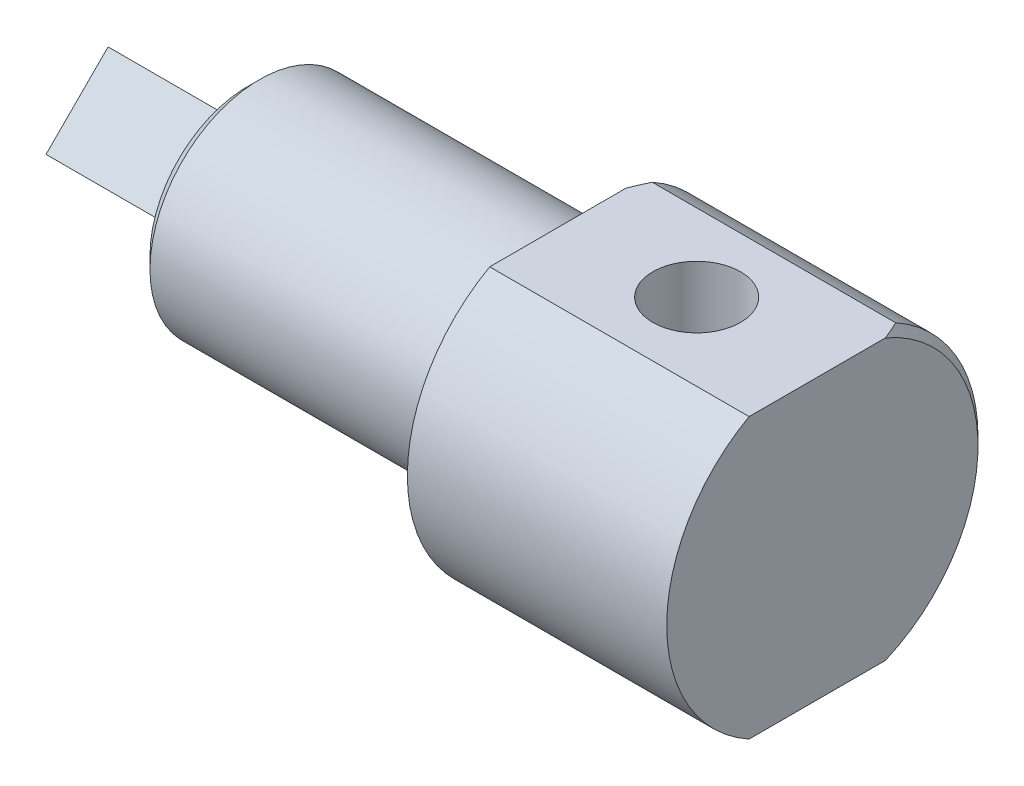
from build123d import *

# Parameters (mm, degrees)
EXTRUDE_1_DEPTH          = 35
SKETCH_4_W               = 45
SKETCH_4_H               = 5
CUT_EXTRUDE_1_DEPTH      = 8
CUT_EXTRUDE_2_DEPTH      = 189.679622641
CUT_EXTRUDE_3_DEPTH      = 166.90660023
CUT_EXTRUDE_3_DEPTH_BACK = 166.90660023
SKETCH_6_R               = 11
CHAMFER_1_SIZE           = 2
CHAMFER_2_SIZE           = 3


with BuildPart() as part:
    # Эскиз1 → Повернуть1 (revolve)
    with BuildSketch(Plane.XY, mode=Mode.PRIVATE) as revolve_1_sk:
        Polygon((0, 0), (0, 27.5), (80, 27.5), (80, 40), (145, 40), (145, 0), align=None)
    revolve(revolve_1_sk.sketch.rotate(Axis((0, 0, 0), (-1, 0, 0)), 90), axis=Axis((0, 0, 0), (-1, 0, 0)))

    # Эскиз3 → Бобышка-Вытянуть1 (add)
    with BuildSketch(Plane.ZY):
        Polygon((0, -15.556349186), (-15.556349186, 0), (0, 15.556349186), (15.556349186, 0), align=None)
    extrude(amount=EXTRUDE_1_DEPTH)

    # Эскиз4 → Вырез-Вытянуть1 (cut, symmetric)
    with BuildSketch(Plane(origin=(0, 0, 0), x_dir=(1, 0, 0), z_dir=(0, 1, 0))):
        with Locations((37.5, 25)):
            Rectangle(SKETCH_4_W, SKETCH_4_H)
    extrude(amount=CUT_EXTRUDE_1_DEPTH, both=True, mode=Mode.SUBTRACT)

    # Эскиз5 → Вырез-Вытянуть2 (cut, symmetric)
    with BuildSketch(Plane(origin=(145, 0, 0), x_dir=(0, 0, -1), z_dir=(1, 0, 0))):
        Polygon((-220.667748268, 35), (-19.364916731, 35), (19.364916731, 35), (220.667748268, 35), (220.667748268, 437.605663073), (-220.667748268, 437.605663073), align=None)
    cut_extrude_2 = extrude(amount=CUT_EXTRUDE_2_DEPTH, both=True, mode=Mode.SUBTRACT)

    # Зеркальное отражение1: Вырез-Вытянуть2 across plane
    add(cut_extrude_2.mirror(Plane.ZX), mode=Mode.SUBTRACT)

    # Эскиз6 → Вырез-Вытянуть3 (cut, two sides: drawn at the far end of the back side and taken through both)
    with BuildSketch(Plane(origin=(0, 35, 0), x_dir=(1, 0, 0), z_dir=(0, 1, 0)).offset(-CUT_EXTRUDE_3_DEPTH_BACK)):
        with Locations(Location((112.5, 0, 0), (0, 0, 270))):
            Circle(SKETCH_6_R)
    extrude(amount=CUT_EXTRUDE_3_DEPTH + CUT_EXTRUDE_3_DEPTH_BACK, mode=Mode.SUBTRACT)

    # Фаска1
    chamfer_1_edges = [part.edges().sort_by_distance(p)[0] for p in [
        (145, 0, -40),
        (80, 0, -40),
    ]]
    chamfer(chamfer_1_edges, length=CHAMFER_1_SIZE)

    # Фаска2
    chamfer_2_edges = [part.edges().sort_by_distance(p)[0] for p in [
        (0, 0, 27.5),
    ]]
    chamfer(chamfer_2_edges, length=CHAMFER_2_SIZE)


solid = part.part
